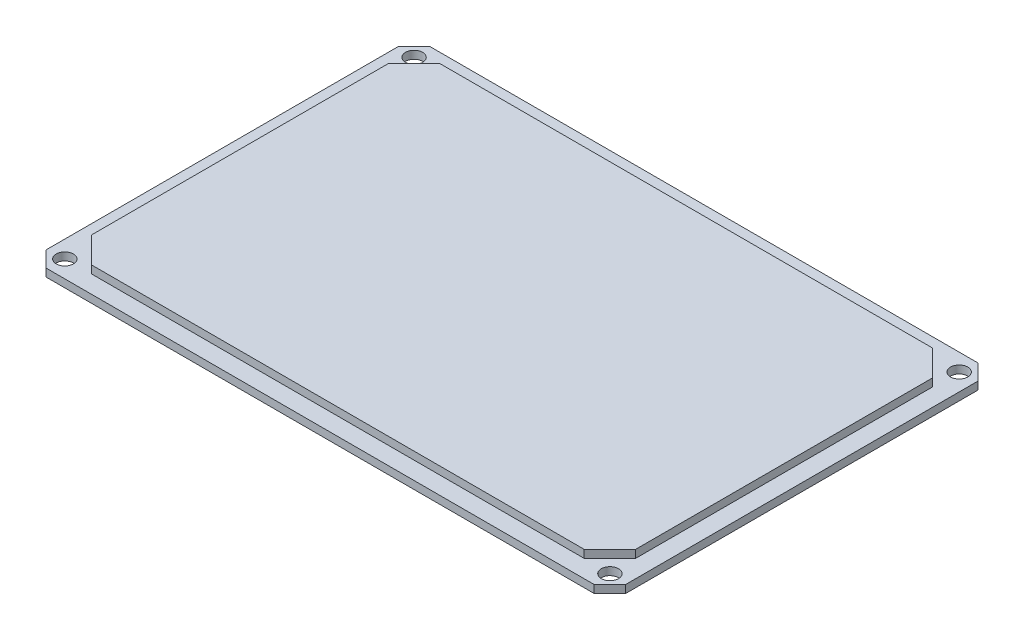
from build123d import *

# Parameters (mm, degrees)
SKETCH1_W           = 74
SKETCH1_H           = 49
BOSS_EXTRUDE1_DEPTH = 1
SKETCH2_W           = 69.5
SKETCH2_H           = 44.5
BOSS_EXTRUDE2_DEPTH = 1
CHAMFER1_SIZE       = 2
CHAMFER2_SIZE       = 3.3
SKETCH3_R           = 1.1
CUT_EXTRUDE1_DEPTH  = 1


with BuildPart() as part:
    # Sketch1 → Boss-Extrude1 (new body)
    with BuildSketch(Plane(origin=(0, 0, 0), x_dir=(1, 0, 0), z_dir=(0, 1, 0))):
        Rectangle(SKETCH1_W, SKETCH1_H)
    extrude(amount=BOSS_EXTRUDE1_DEPTH)

    # Sketch2 → Boss-Extrude2 (add)
    with BuildSketch(Plane(origin=(0, 1, 0), x_dir=(1, 0, 0), z_dir=(0, 1, 0))):
        Rectangle(SKETCH2_W, SKETCH2_H)
    extrude(amount=BOSS_EXTRUDE2_DEPTH)

    # Chamfer1
    chamfer1_edges = [part.edges().sort_by_distance(p)[0] for p in [
        (37, 0.5, 24.5),
        (-37, 0.5, 24.5),
        (-37, 0.5, -24.5),
        (37, 0.5, -24.5),
    ]]
    chamfer(chamfer1_edges, length=CHAMFER1_SIZE)

    # Chamfer2
    chamfer2_edges = [part.edges().sort_by_distance(p)[0] for p in [
        (34.75, 1.5, 22.25),
        (34.75, 1.5, -22.25),
        (-34.75, 1.5, -22.25),
        (-34.75, 1.5, 22.25),
    ]]
    chamfer(chamfer2_edges, length=CHAMFER2_SIZE)

    # Sketch3 → Cut-Extrude1 (cut)
    with BuildSketch(Plane(origin=(0, 1, 0), x_dir=(1, 0, 0), z_dir=(0, 1, 0))):
        with Locations(Location((-34.8, 22.3, 0), (0, 0, 270))):
            Circle(SKETCH3_R)
        with Locations(Location((34.8, 22.3, 0), (0, 0, 270))):
            Circle(SKETCH3_R)
        with Locations(Location((34.8, -22.3, 0), (0, 0, 270))):
            Circle(SKETCH3_R)
        with Locations(Location((-34.8, -22.3, 0), (0, 0, 270))):
            Circle(SKETCH3_R)
    extrude(amount=-CUT_EXTRUDE1_DEPTH, mode=Mode.SUBTRACT)


solid = part.part
